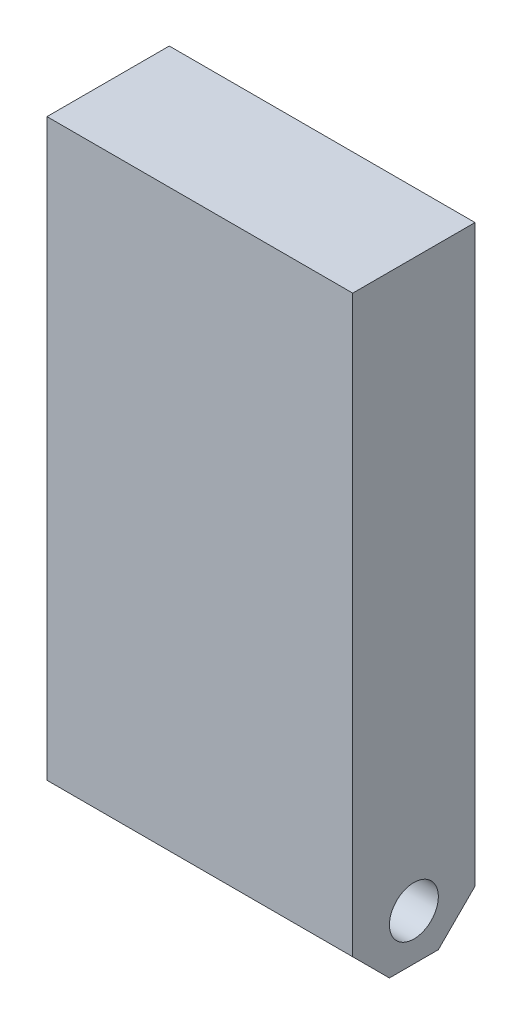
from build123d import *

# Parameters (mm, degrees)
SKETCH_1_W          = 50
SKETCH_1_H          = 100
EXTRUDE_1_DEPTH     = 10
SKETCH_2_R          = 4
CUT_EXTRUDE_1_DEPTH = 113.249721603
CHAMFER_1_SIZE      = 6


with BuildPart() as part:
    # 草图1 → 凸台-拉伸1 (new, symmetric)
    with BuildSketch(Plane.XY):
        with Locations((0, 50)):
            Rectangle(SKETCH_1_W, SKETCH_1_H)
    extrude(amount=EXTRUDE_1_DEPTH, both=True)

    # 草图2 → 切除-拉伸1 (cut, through all)
    with BuildSketch(Plane.ZY.offset(25)):
        with Locations((0, 7.522576351)):
            Circle(SKETCH_2_R)
    extrude(amount=-CUT_EXTRUDE_1_DEPTH, mode=Mode.SUBTRACT)

    # 倒角1
    chamfer_1_edges = [part.edges().sort_by_distance(p)[0] for p in [
        (0, 0, 10),
        (0, 0, -10),
    ]]
    chamfer(chamfer_1_edges, length=CHAMFER_1_SIZE)


solid = part.part
